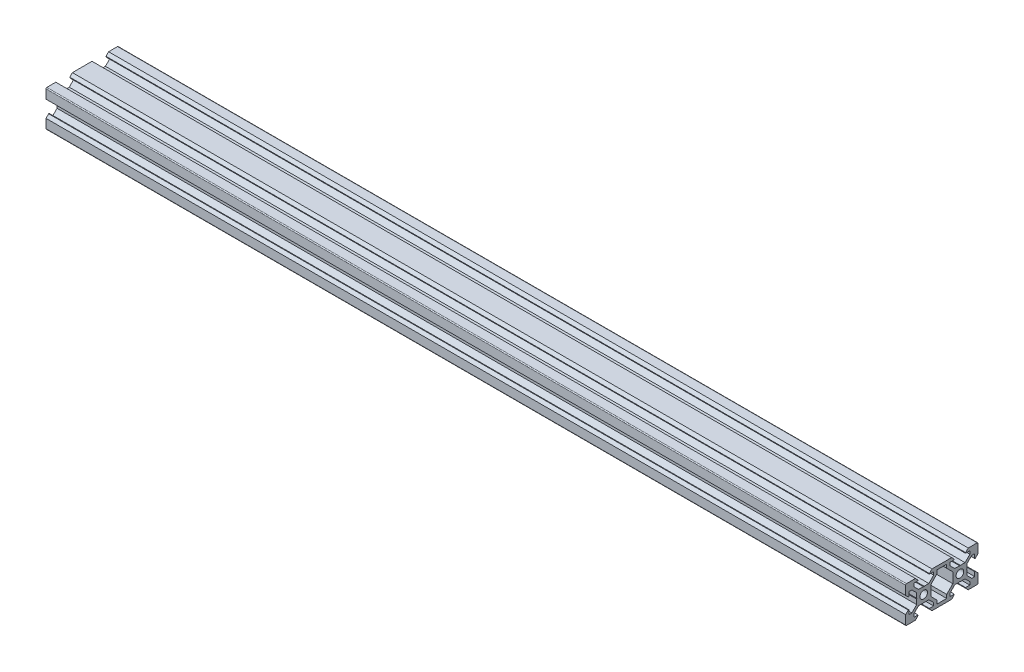
from build123d import *

# Parameters (mm, degrees)
PROFILE_SKETCH_R      = 2.1
PROFILE_EXTRUDE_DEPTH = 475


with BuildPart() as part:
    # Profile Sketch → Profile Extrude (new body)
    with BuildSketch(Plane(origin=(0, 0, 0), x_dir=(0, 0, -1), z_dir=(1, 0, 0))):
        with BuildLine():
            Line((5.42, 10), (-5.42, 10))
            Line((-5.42, 10), (-6.875, 8.545))
            Line((-6.875, 8.545), (-6.875, 8.2))
            Line((-6.875, 8.2), (-4.5, 8.2))
            Line((-4.5, 8.2), (-4.5, 6.56))
            Line((-4.5, 6.56), (-7.16, 3.9))
            Line((-7.16, 3.9), (-9.79, 3.9))
            Line((-9.79, 3.9), (-10, 3.69))
            Line((-10, 3.69), (-10.21, 3.9))
            Line((-10.21, 3.9), (-12.84, 3.9))
            Line((-12.84, 3.9), (-15.5, 6.56))
            Line((-15.5, 6.56), (-15.5, 8.2))
            Line((-15.5, 8.2), (-13.125, 8.2))
            Line((-13.125, 8.2), (-13.125, 8.545))
            Line((-13.125, 8.545), (-14.58, 10))
            Line((-14.58, 10), (-19.5, 10))
            ThreePointArc((-19.5, 10), (-19.853553391, 9.853553391), (-20, 9.5))
            Line((-20, 9.5), (-20, 4.58))
            Line((-20, 4.58), (-18.545, 3.125))
            Line((-18.545, 3.125), (-18.2, 3.125))
            Line((-18.2, 3.125), (-18.2, 5.5))
            Line((-18.2, 5.5), (-16.56, 5.5))
            Line((-16.56, 5.5), (-13.9, 2.838679656))
            Line((-13.9, 2.838679656), (-13.9, 0.21))
            Line((-13.9, 0.21), (-13.69, 0))
            Line((-13.69, 0), (-13.9, -0.21))
            Line((-13.9, -0.21), (-13.9, -2.838679656))
            Line((-13.9, -2.838679656), (-16.56, -5.5))
            Line((-16.56, -5.5), (-18.2, -5.5))
            Line((-18.2, -5.5), (-18.2, -3.125))
            Line((-18.2, -3.125), (-18.545, -3.125))
            Line((-18.545, -3.125), (-20, -4.58))
            Line((-20, -4.58), (-20, -9.5))
            ThreePointArc((-20, -9.5), (-19.853553391, -9.853553391), (-19.5, -10))
            Line((-19.5, -10), (-14.58, -10))
            Line((-14.58, -10), (-13.125, -8.545))
            Line((-13.125, -8.545), (-13.125, -8.2))
            Line((-13.125, -8.2), (-15.5, -8.2))
            Line((-15.5, -8.2), (-15.5, -6.56))
            Line((-15.5, -6.56), (-12.84, -3.9))
            Line((-12.84, -3.9), (-10.21, -3.9))
            Line((-10.21, -3.9), (-10, -3.69))
            Line((-10, -3.69), (-9.79, -3.9))
            Line((-9.79, -3.9), (-7.16, -3.9))
            Line((-7.16, -3.9), (-4.5, -6.56))
            Line((-4.5, -6.56), (-4.5, -8.2))
            Line((-4.5, -8.2), (-6.875, -8.2))
            Line((-6.875, -8.2), (-6.875, -8.545))
            Line((-6.875, -8.545), (-5.42, -10))
            Line((-5.42, -10), (5.42, -10))
            Line((5.42, -10), (6.875, -8.545))
            Line((6.875, -8.545), (6.875, -8.2))
            Line((6.875, -8.2), (4.5, -8.2))
            Line((4.5, -8.2), (4.5, -6.56))
            Line((4.5, -6.56), (7.16, -3.9))
            Line((7.16, -3.9), (9.79, -3.9))
            Line((9.79, -3.9), (10, -3.69))
            Line((10, -3.69), (10.21, -3.9))
            Line((10.21, -3.9), (12.84, -3.9))
            Line((12.84, -3.9), (15.5, -6.56))
            Line((15.5, -6.56), (15.5, -8.2))
            Line((15.5, -8.2), (13.125, -8.2))
            Line((13.125, -8.2), (13.125, -8.545))
            Line((13.125, -8.545), (14.58, -10))
            Line((14.58, -10), (19.5, -10))
            ThreePointArc((19.5, -10), (19.853553391, -9.853553391), (20, -9.5))
            Line((20, -9.5), (20, -4.58))
            Line((20, -4.58), (18.545, -3.125))
            Line((18.545, -3.125), (18.2, -3.125))
            Line((18.2, -3.125), (18.2, -5.5))
            Line((18.2, -5.5), (16.56, -5.5))
            Line((16.56, -5.5), (13.9, -2.838679656))
            Line((13.9, -2.838679656), (13.9, -0.21))
            Line((13.9, -0.21), (13.69, 0))
            Line((13.69, 0), (13.9, 0.21))
            Line((13.9, 0.21), (13.9, 2.838679656))
            Line((13.9, 2.838679656), (16.56, 5.5))
            Line((16.56, 5.5), (18.2, 5.5))
            Line((18.2, 5.5), (18.2, 3.125))
            Line((18.2, 3.125), (18.545, 3.125))
            Line((18.545, 3.125), (20, 4.58))
            Line((20, 4.58), (20, 9.5))
            ThreePointArc((20, 9.5), (19.853553391, 9.853553391), (19.5, 10))
            Line((19.5, 10), (14.58, 10))
            Line((14.58, 10), (13.125, 8.545))
            Line((13.125, 8.545), (13.125, 8.2))
            Line((13.125, 8.2), (15.5, 8.2))
            Line((15.5, 8.2), (15.5, 6.56))
            Line((15.5, 6.56), (12.84, 3.9))
            Line((12.84, 3.9), (10.21, 3.9))
            Line((10.21, 3.9), (10, 3.69))
            Line((10, 3.69), (9.79, 3.9))
            Line((9.79, 3.9), (7.16, 3.9))
            Line((7.16, 3.9), (4.5, 6.56))
            Line((4.5, 6.56), (4.5, 8.2))
            Line((4.5, 8.2), (6.875, 8.2))
            Line((6.875, 8.2), (6.875, 8.545))
            Line((6.875, 8.545), (5.42, 10))
        make_face()
        with Locations(Location((-10, 0, 0), (0, 0, 180))):
            Circle(PROFILE_SKETCH_R, mode=Mode.SUBTRACT)
        with Locations(Location((10, 0, 0), (0, 0, 180))):
            Circle(PROFILE_SKETCH_R, mode=Mode.SUBTRACT)
        Polygon((2.7, 8.2), (-2.7, 8.2), (-2.7, 6.238679656), (-6.1, 2.838679656), (-6.1, -0.21), (-6.1, -2.838679656), (-2.7, -6.238679656), (-2.7, -8.2), (2.7, -8.2), (2.7, -6.238679656), (6.1, -2.838679656), (6.1, -0.21), (6.1, 2.838679656), (2.7, 6.238679656), align=None, mode=Mode.SUBTRACT)
    extrude(amount=PROFILE_EXTRUDE_DEPTH)


solid = part.part
